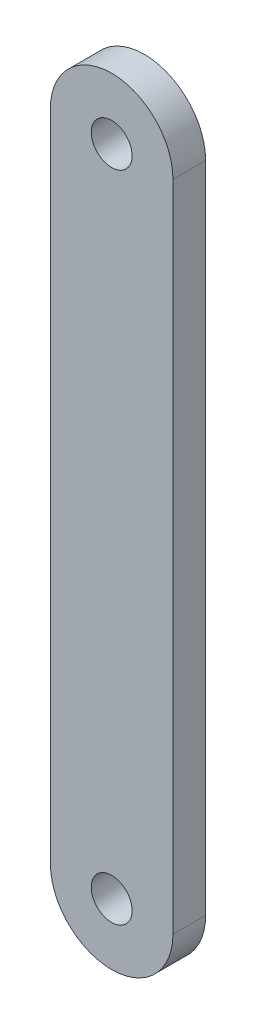
from build123d import *

# Parameters (mm, degrees)
SKETCH1_R           = 1.5875
BOSS_EXTRUDE1_DEPTH = 2.54


with BuildPart() as part:
    # Sketch1 → Boss-Extrude1 (new body)
    with BuildSketch(Plane.XY):
        with BuildLine():
            Line((-4.7625, -25.4), (-4.7625, 25.4))
            ThreePointArc((-4.7625, 25.4), (0, 30.1625), (4.7625, 25.4))
            Line((4.7625, 25.4), (4.7625, -25.4))
            ThreePointArc((4.7625, -25.4), (0, -30.1625), (-4.7625, -25.4))
        make_face()
        with Locations((0, 25.4)):
            Circle(SKETCH1_R, mode=Mode.SUBTRACT)
        with Locations((0, -25.4)):
            Circle(SKETCH1_R, mode=Mode.SUBTRACT)
    extrude(amount=BOSS_EXTRUDE1_DEPTH)


solid = part.part
